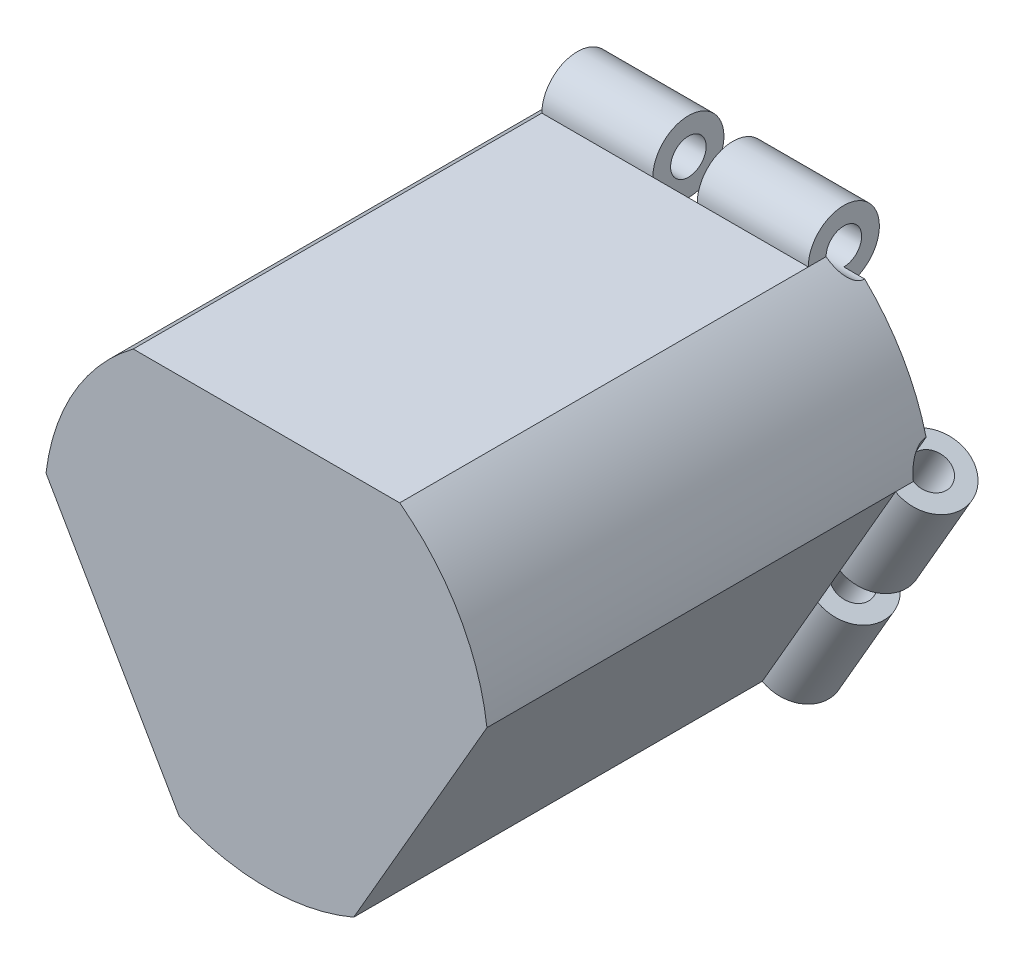
from build123d import *
from build123d.topology import SkipClean

# Parameters (mm, degrees)
CROQUIS1_R              = 25
SALIENTE_EXTRUIR1_DEPTH = 50
CORTAR_EXTRUIR1_DEPTH   = 50
MATRIZC2_COUNT          = 3
CROQUIS4_R              = 4
CROQUIS4_R_2            = 2
SALIENTE_EXTRUIR2_DEPTH = 15
CROQUIS4_2_R            = 2
CORTAR_EXTRUIR3_DEPTH   = 20
MATRIZC3_COUNT          = 3
MATRIZC4_COUNT          = 3
CROQUIS4_3_R            = 4
CROQUIS4_3_R_2          = 2
CORTAR_EXTRUIR4_DEPTH   = 2.5
MATRIZC5_COUNT          = 3


with BuildPart() as part:
    # Croquis1 → Saliente-Extruir1 (new body)
    with BuildSketch(Plane.XY):
        Circle(CROQUIS1_R)
    extrude(amount=SALIENTE_EXTRUIR1_DEPTH)

    # Croquis2 → Cortar-Extruir1 (cut)
    with BuildSketch(Plane(origin=(0, 0, 0), x_dir=(-1, 0, 0), z_dir=(0, 0, -1))):
        with BuildLine():
            Line((-15, 20), (15, 20))
            ThreePointArc((15, 20), (0, 25), (-15, 20))
        make_face()
    cortar_extruir1 = extrude(amount=-CORTAR_EXTRUIR1_DEPTH, mode=Mode.SUBTRACT)

    # MatrizC2: Cortar-Extruir1 ×3 about axis
    matrizc2_axis = Axis((0, 0, 0), (0, 0, 1))
    for i in range(1, MATRIZC2_COUNT):
        add(cortar_extruir1.rotate(matrizc2_axis, i * 360 / MATRIZC2_COUNT), mode=Mode.SUBTRACT)

    # Croquis4 → Saliente-Extruir2 (add, symmetric)
    with BuildSketch(Plane(origin=(0, 0, 0), x_dir=(0, 0, -1), z_dir=(1, 0, 0))):
        with Locations((0, 20)):
            Circle(CROQUIS4_R)
        with Locations((0, 20)):
            Circle(CROQUIS4_R_2, mode=Mode.SUBTRACT)
    saliente_extruir2 = extrude(amount=SALIENTE_EXTRUIR2_DEPTH, both=True)

    # Croquis4<2> → Cortar-Extruir3 (cut, symmetric)
    with SkipClean():  # the faces are left unmerged after this step: merging them gives an invalid solid
        with BuildSketch(Plane(origin=(0, 0, 0), x_dir=(0, 0, -1), z_dir=(1, 0, 0))):
            with Locations(Location((0, 20, 0), (0, 0, 180))):
                Circle(CROQUIS4_2_R)
        cortar_extruir3 = extrude(amount=CORTAR_EXTRUIR3_DEPTH, both=True, mode=Mode.SUBTRACT)

    # MatrizC3: Saliente-Extruir2 ×3 about axis
    with SkipClean():  # the faces are left unmerged after this step: merging them gives an invalid solid
        matrizc3_axis = Axis((0, 0, 0), (0, 0, 1))
        for i in range(1, MATRIZC3_COUNT):
            add(saliente_extruir2.rotate(matrizc3_axis, i * 360 / MATRIZC3_COUNT))

    # MatrizC4: Cortar-Extruir3 ×3 about axis
    with SkipClean():  # the faces are left unmerged after this step: merging them gives an invalid solid
        matrizc4_axis = Axis((0, 0, 50), (0, 0, -1))
        for i in range(1, MATRIZC4_COUNT):
            add(cortar_extruir3.rotate(matrizc4_axis, i * 360 / MATRIZC4_COUNT), mode=Mode.SUBTRACT)

    # Croquis4<3> → Cortar-Extruir4 (cut, symmetric)
    with BuildSketch(Plane(origin=(0, 0, 0), x_dir=(0, 0, -1), z_dir=(1, 0, 0))):
        with Locations((0, 20)):
            Circle(CROQUIS4_3_R)
        with Locations(Location((0, 20, 0), (0, 0, 180))):
            Circle(CROQUIS4_3_R_2, mode=Mode.SUBTRACT)
    cortar_extruir4 = extrude(amount=CORTAR_EXTRUIR4_DEPTH, both=True, mode=Mode.SUBTRACT)

    # MatrizC5: Cortar-Extruir4 ×3 about axis
    matrizc5_axis = Axis((0, 0, 0), (0, 0, 1))
    for i in range(1, MATRIZC5_COUNT):
        add(cortar_extruir4.rotate(matrizc5_axis, i * 360 / MATRIZC5_COUNT), mode=Mode.SUBTRACT)


solid = part.part
